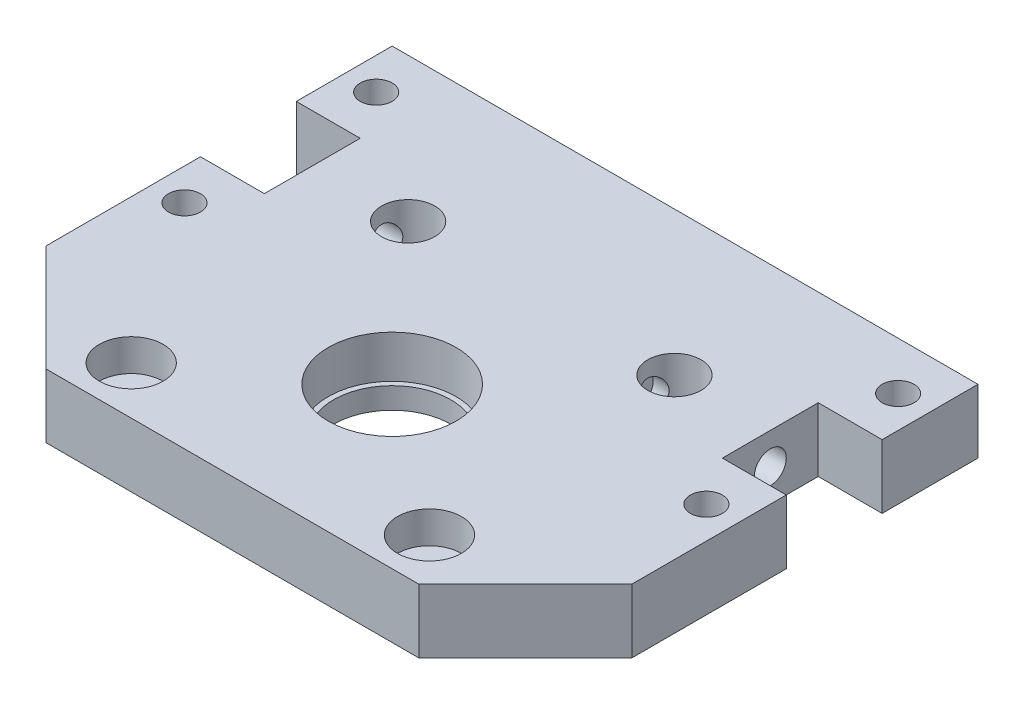
from build123d import *

# Parameters (mm, degrees)
SKETCH1_W           = 66
SKETCH1_H           = 85
SKETCH1_R           = 11
BOSS_EXTRUDE1_DEPTH = 12
BOSS_EXTRUDE3_DEPTH = 12
SKETCH4_R           = 12
CUT_EXTRUDE1_DEPTH  = 8
SKETCH6_R           = 6
CUT_EXTRUDE2_DEPTH  = 6
CHAMFER1_SIZE       = 20
CUT_EXTRUDE3_REACH  = 84.274
SKETCH7_R           = 3
SKETCH7_R_2         = 5
SKETCH9_R           = 3
CUT_EXTRUDE5_DEPTH  = 25


with BuildPart() as part:
    # Sketch1 → Boss-Extrude1 (new body)
    with BuildSketch(Plane(origin=(0, 0, 0), x_dir=(1, 0, 0), z_dir=(0, 1, 0))):
        with Locations((0, -17.5)):
            Rectangle(SKETCH1_W, SKETCH1_H)
        with Locations(Location((0, -30, 0), (0, 0, 270))):
            Circle(SKETCH1_R, mode=Mode.SUBTRACT)
    extrude(amount=BOSS_EXTRUDE1_DEPTH)

    # Sketch3 → Boss-Extrude3 (add)
    with BuildSketch(Plane(origin=(0, 12, 0), x_dir=(1, 0, 0), z_dir=(0, 1, 0))):
        Polygon((55, 7), (43, 7), (43, -11), (55, -11), (55, -60), (33, -60), (33, 25), (55, 25), align=None)
    boss_extrude3 = extrude(amount=-BOSS_EXTRUDE3_DEPTH)

    # Mirror1: Boss-Extrude3 across plane
    add(boss_extrude3.mirror(Plane(origin=(0, 0, 0), x_dir=(0, 0, 1), z_dir=(1, 0, 0))))

    # Sketch4 → Cut-Extrude1 (cut)
    with BuildSketch(Plane(origin=(0, 12, 0), x_dir=(1, 0, 0), z_dir=(0, 1, 0))):
        with Locations(Location((0, -30, 0), (0, 0, 270))):
            Circle(SKETCH4_R)
    extrude(amount=-CUT_EXTRUDE1_DEPTH, mode=Mode.SUBTRACT)

    # Sketch6 → Cut-Extrude2 (cut)
    with BuildSketch(Plane(origin=(0, 12, 0), x_dir=(1, 0, 0), z_dir=(0, 1, 0))):
        with Locations(Location((-28, -51, 0), (0, 0, 270))):
            Circle(SKETCH6_R)
        with Locations(Location((28, -51, 0), (0, 0, 270))):
            Circle(SKETCH6_R)
    extrude(amount=-CUT_EXTRUDE2_DEPTH, mode=Mode.SUBTRACT)

    # Chamfer1
    chamfer1_edges = [part.edges().sort_by_distance(p)[0] for p in [
        (55, 6, 60),
        (-55, 6, 60),
    ]]
    chamfer(chamfer1_edges, length=CHAMFER1_SIZE)

    # Sketch7 → Cut-Extrude3 (cut, up to next)
    with BuildSketch(Plane(origin=(0, 12, 0), x_dir=(1, 0, 0), z_dir=(0, 1, 0)), mode=Mode.PRIVATE) as cut_extrude3_sk1:
        with Locations(Location((-49, 16, 0), (0, 0, 270))):
            Circle(SKETCH7_R)
    cut_extrude3_tool1 = extrude(cut_extrude3_sk1.sketch, amount=-CUT_EXTRUDE3_REACH, mode=Mode.PRIVATE) & part.part
    # Sketch7 → Cut-Extrude3 (cut, up to next)
    with BuildSketch(Plane(origin=(0, 12, 0), x_dir=(1, 0, 0), z_dir=(0, 1, 0)), mode=Mode.PRIVATE) as cut_extrude3_sk2:
        with Locations(Location((-49, -20, 0), (0, 0, 270))):
            Circle(SKETCH7_R)
    cut_extrude3_tool2 = extrude(cut_extrude3_sk2.sketch, amount=-CUT_EXTRUDE3_REACH, mode=Mode.PRIVATE) & part.part
    # Sketch7 → Cut-Extrude3 (cut, up to next)
    with BuildSketch(Plane(origin=(0, 12, 0), x_dir=(1, 0, 0), z_dir=(0, 1, 0)), mode=Mode.PRIVATE) as cut_extrude3_sk3:
        with Locations(Location((-25, -2, 0), (0, 0, 270))):
            Circle(SKETCH7_R_2)
    cut_extrude3_tool3 = extrude(cut_extrude3_sk3.sketch, amount=-CUT_EXTRUDE3_REACH, mode=Mode.PRIVATE) & part.part
    cut_extrude3_1 = cut_extrude3_tool1.solids().sort_by_distance((-49, 12, -16))[0]
    add(cut_extrude3_1, mode=Mode.SUBTRACT)
    cut_extrude3_2 = cut_extrude3_tool2.solids().sort_by_distance((-49, 12, 20))[0]
    add(cut_extrude3_2, mode=Mode.SUBTRACT)
    cut_extrude3_3 = cut_extrude3_tool3.solids().sort_by_distance((-25, 12, 2))[0]
    add(cut_extrude3_3, mode=Mode.SUBTRACT)
    cut_extrude3 = cut_extrude3_1 + cut_extrude3_2 + cut_extrude3_3  # Cut-Extrude3 as one shape, for the pattern or mirror that repeats it

    # Sketch9 → Cut-Extrude5 (cut)
    with BuildSketch(Plane.ZY.offset(43)):
        with Locations((2, 6)):
            Circle(SKETCH9_R)
    cut_extrude5 = extrude(amount=-CUT_EXTRUDE5_DEPTH, mode=Mode.SUBTRACT)

    # Mirror2: Cut-Extrude3, Cut-Extrude5 across plane
    add(cut_extrude3.mirror(Plane(origin=(0, 0, 0), x_dir=(0, 0, 1), z_dir=(1, 0, 0))), mode=Mode.SUBTRACT)
    add(cut_extrude5.mirror(Plane(origin=(0, 0, 0), x_dir=(0, 0, 1), z_dir=(1, 0, 0))), mode=Mode.SUBTRACT)


solid = part.part
